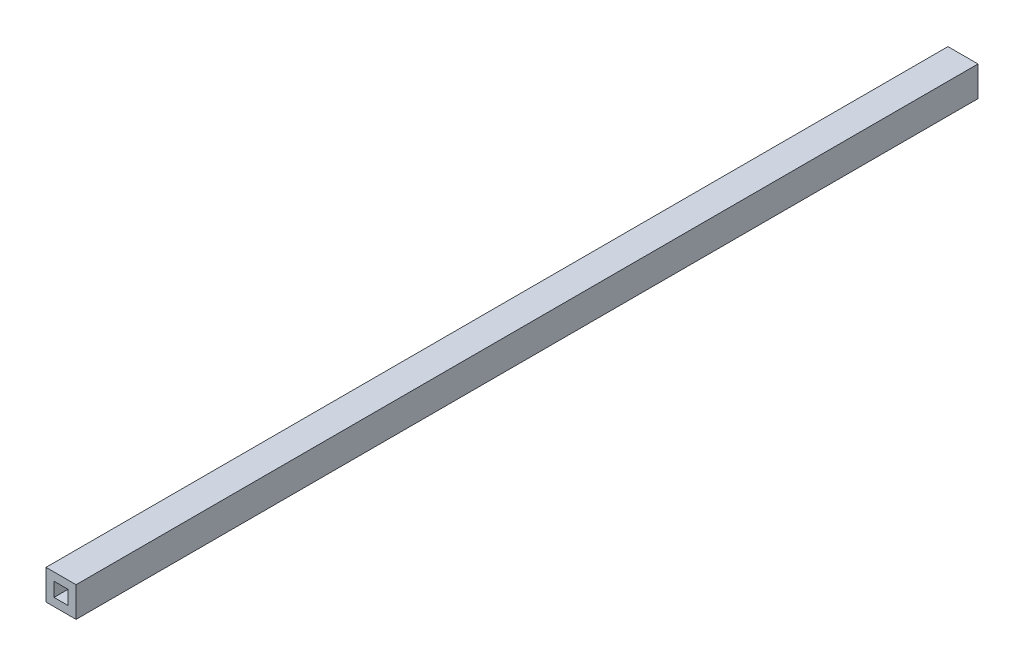
from build123d import *

# Parameters (mm, degrees)
SKETCH1_W           = 19.05
SKETCH1_H           = 19.05
SKETCH1_W_2         = 8.89
SKETCH1_H_2         = 8.89
BOSS_EXTRUDE1_DEPTH = 571.5


with BuildPart() as part:
    # Sketch1 → Boss-Extrude1 (new body)
    with BuildSketch(Plane.XY):
        with Locations((3.580319149, -6.079787234)):
            Rectangle(SKETCH1_W, SKETCH1_H)
        with Locations((3.580319149, -6.079787234)):
            Rectangle(SKETCH1_W_2, SKETCH1_H_2, mode=Mode.SUBTRACT)
    extrude(amount=BOSS_EXTRUDE1_DEPTH)


solid = part.part
